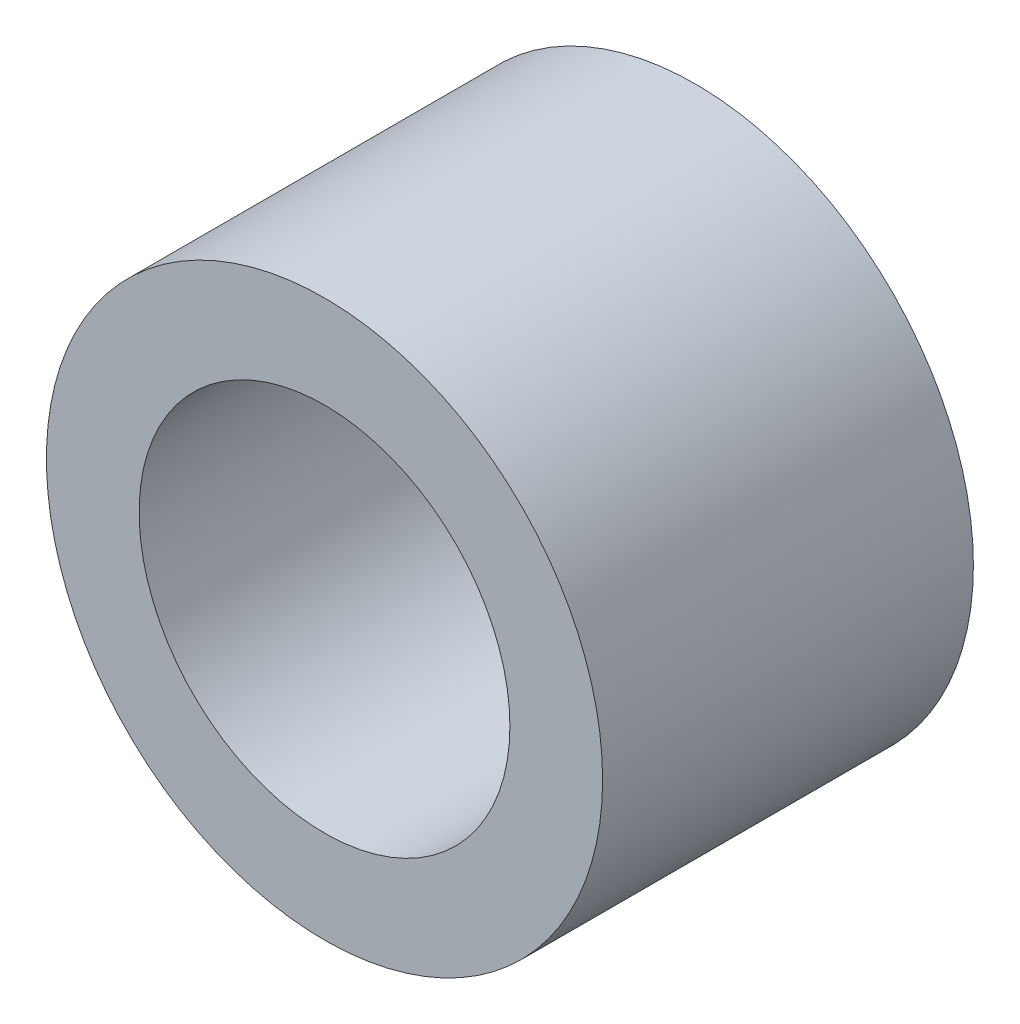
from build123d import *

# Parameters (mm, degrees)
BOSS_EXTRUDE1_START = 25.4
SKETCH1_R           = 38.1
SKETCH1_R_2         = 25.4
BOSS_EXTRUDE1_DEPTH = 50.8


with BuildPart() as part:
    # Sketch1 → Boss-Extrude1 (new body)
    with BuildSketch(Plane.XY.offset(BOSS_EXTRUDE1_START)):
        Circle(SKETCH1_R)
        Circle(SKETCH1_R_2, mode=Mode.SUBTRACT)
    extrude(amount=-BOSS_EXTRUDE1_DEPTH)


solid = part.part
